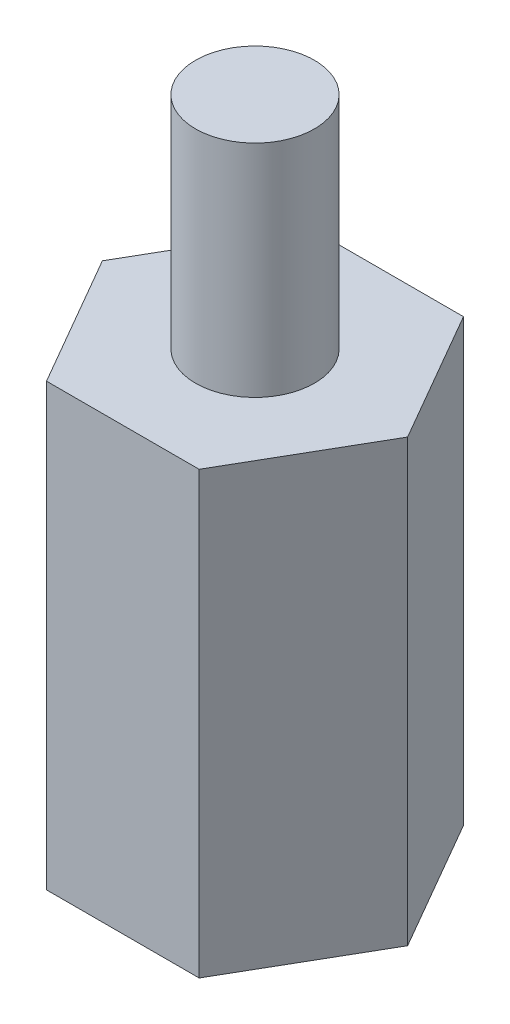
from build123d import *

# Parameters (mm, degrees)
EXTRUDE_1_DEPTH     = 10
SKETCH_2_R          = 1.35
EXTRUDE_2_DEPTH     = 5
SKETCH_3_R          = 1.35
CUT_EXTRUDE_1_DEPTH = 6


with BuildPart() as part:
    # 스케치1 → 보스-돌출1 (new body)
    with BuildSketch(Plane(origin=(0, 0, 0), x_dir=(1, 0, 0), z_dir=(0, 1, 0))):
        Polygon((3.464101615, 0), (1.732050808, 3), (-1.732050808, 3), (-3.464101615, 0), (-1.732050808, -3), (1.732050808, -3), align=None)
    extrude(amount=EXTRUDE_1_DEPTH)

    # 스케치2 → 보스-돌출2 (add)
    with BuildSketch(Plane(origin=(0, 10, 0), x_dir=(1, 0, 0), z_dir=(0, 1, 0))):
        with Locations(Location((0, 0, 0), (0, 0, 270))):
            Circle(SKETCH_2_R)
    extrude(amount=EXTRUDE_2_DEPTH)

    # 스케치3 → 컷-돌출1 (cut)
    with BuildSketch(Plane.XZ):
        with Locations(Location((0, 0, 0), (0, 0, 90))):
            Circle(SKETCH_3_R)
    extrude(amount=-CUT_EXTRUDE_1_DEPTH, mode=Mode.SUBTRACT)


solid = part.part
